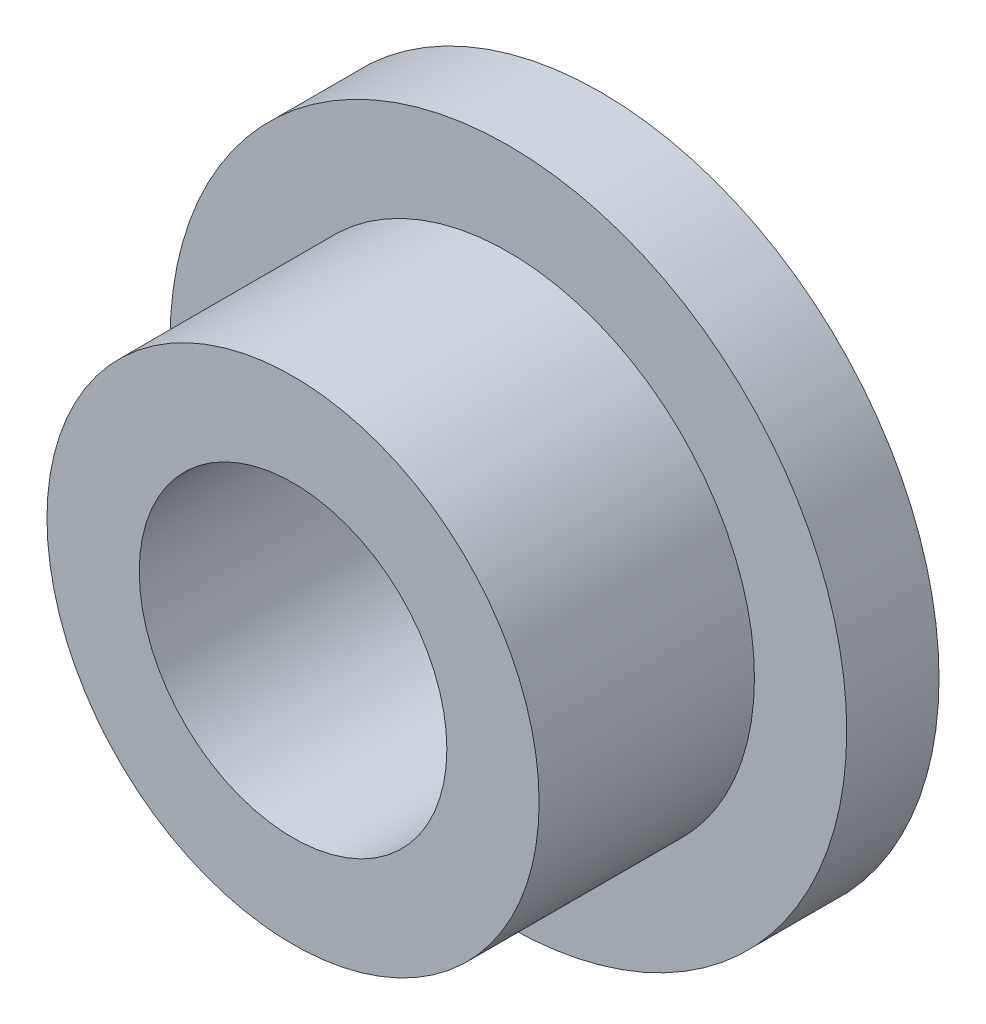
from build123d import *

# Parameters (mm, degrees)
SKETCH1_R           = 11
BOSS_EXTRUDE1_DEPTH = 3
SKETCH2_R           = 8
BOSS_EXTRUDE2_DEPTH = 7
SKETCH3_R           = 5
CUT_EXTRUDE1_DEPTH  = 19.493242009


with BuildPart() as part:
    # Sketch1 → Boss-Extrude1 (new body)
    with BuildSketch(Plane.XY):
        Circle(SKETCH1_R)
    extrude(amount=BOSS_EXTRUDE1_DEPTH)

    # Sketch2 → Boss-Extrude2 (add)
    with BuildSketch(Plane.XY.offset(3)):
        Circle(SKETCH2_R)
    extrude(amount=BOSS_EXTRUDE2_DEPTH)

    # Sketch3 → Cut-Extrude1 (cut, through all)
    with BuildSketch(Plane.XY.offset(10)):
        Circle(SKETCH3_R)
    extrude(amount=-CUT_EXTRUDE1_DEPTH, mode=Mode.SUBTRACT)


solid = part.part
